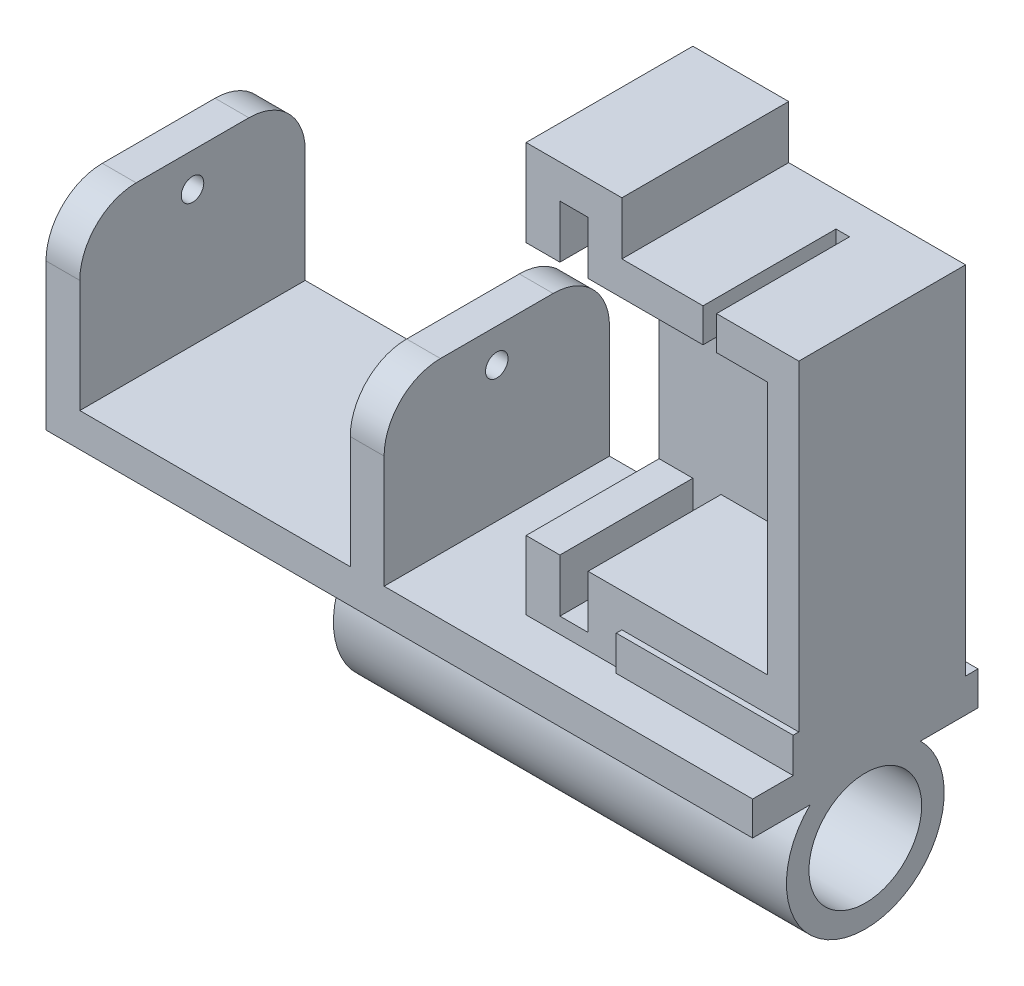
from build123d import *

# Parameters (mm, degrees)
SKETCH1_W           = 50
SKETCH1_H           = 20
BOSS_EXTRUDE1_DEPTH = 3
SKETCH2_W           = 3
SKETCH2_H           = 20
BOSS_EXTRUDE2_DEPTH = 15
SKETCH3_R           = 1
CUT_EXTRUDE1_DEPTH  = 15
FILLET1_R           = 5
SKETCH4_W           = 3
SKETCH4_H           = 20
BOSS_EXTRUDE3_DEPTH = 15
CUT_EXTRUDE2_START  = -15
SKETCH5_R           = 1
CUT_EXTRUDE2_DEPTH  = 15
FILLET2_R           = 5
BOSS_EXTRUDE4_DEPTH = 5.9
SKETCH7_W           = 20
SKETCH7_H           = 3
BOSS_EXTRUDE5_DEPTH = 12.8
SKETCH8_W           = 15.8
SKETCH8_H           = 3.1
BOSS_EXTRUDE6_DEPTH = 6.4
BOSS_EXTRUDE7_DEPTH = 3
SKETCH10_W          = 43.689261584
SKETCH10_H          = 59.678024431
CUT_EXTRUDE4_DEPTH  = 0.2
SKETCH11_R          = 7
SKETCH11_R_2        = 5
BOSS_EXTRUDE8_DEPTH = 40.2


with BuildPart() as part:
    # Sketch1 → Boss-Extrude1 (new body)
    with BuildSketch(Plane(origin=(0, 0, 0), x_dir=(1, 0, 0), z_dir=(0, 1, 0))):
        with Locations((25, -10)):
            Rectangle(SKETCH1_W, SKETCH1_H)
    extrude(amount=BOSS_EXTRUDE1_DEPTH)

    # Sketch2 → Boss-Extrude2 (add)
    with BuildSketch(Plane(origin=(0, 3, 0), x_dir=(1, 0, 0), z_dir=(0, 1, 0))):
        with Locations((1.5, -10)):
            Rectangle(SKETCH2_W, SKETCH2_H)
    extrude(amount=BOSS_EXTRUDE2_DEPTH)

    # Sketch3 → Cut-Extrude1 (cut)
    with BuildSketch(Plane(origin=(3, 0, 0), x_dir=(0, 0, -1), z_dir=(1, 0, 0))):
        with Locations((-10, 15)):
            Circle(SKETCH3_R)
    extrude(amount=-CUT_EXTRUDE1_DEPTH, mode=Mode.SUBTRACT)

    # Fillet1
    fillet1_edges = [part.edges().sort_by_distance(p)[0] for p in [
        (1.5, 18, 20),
        (1.5, 18, 0),
    ]]
    fillet(fillet1_edges, radius=FILLET1_R)

    # Sketch4 → Boss-Extrude3 (add)
    with BuildSketch(Plane(origin=(0, 3, 0), x_dir=(1, 0, 0), z_dir=(0, 1, 0))):
        with Locations((28.5, -10)):
            Rectangle(SKETCH4_W, SKETCH4_H)
    extrude(amount=BOSS_EXTRUDE3_DEPTH)

    # Sketch5 → Cut-Extrude2 (cut)
    with BuildSketch(Plane.ZY.offset(-27).offset(CUT_EXTRUDE2_START)):
        with Locations(Location((10, 15, 0), (0, 0, 180))):
            Circle(SKETCH5_R)
    extrude(amount=CUT_EXTRUDE2_DEPTH, mode=Mode.SUBTRACT)

    # Fillet2
    fillet2_edges = [part.edges().sort_by_distance(p)[0] for p in [
        (28.5, 18, 20),
        (28.5, 18, 0),
    ]]
    fillet(fillet2_edges, radius=FILLET2_R)

    # Sketch6 → Boss-Extrude4 (add, symmetric)
    with BuildSketch(Plane(origin=(0, 0, 10), x_dir=(-1, 0, 0), z_dir=(0, 0, -1))):
        Polygon((-38.5, 31.6), (-38.5, 34.6), (-38.5, 39.3), (-47, 39.3), (-47, 34.6), (-54.2, 34.6), (-54.2, 31.6), (-44, 31.6), (-44, 36.3), (-41.5, 36.3), (-41.5, 31.6), align=None)
        Polygon((-38.5, 1.4), (-38.5, 6.1), (-38.5, 9.1), (-41.5, 9.1), (-41.5, 4.4), (-44, 4.4), (-44, 9.1), (-59.9, 9.1), (-59.9, 31.6), (-55.4, 31.6), (-55.4, 34.6), (-62.9, 34.6), (-62.9, 6.1), (-47, 6.1), (-47, 1.4), align=None)
    extrude(amount=BOSS_EXTRUDE4_DEPTH, both=True)


with BuildPart() as boss_extrude4_piece_1:
    # of the separate pieces the step leaves, piece 1, a body of its own (boss_extrude4_pieces)
    add(part.part.solids().sort_by_distance((27, 13, 0))[0])

    # Sketch7 → Boss-Extrude5 (add)
    with BuildSketch(Plane(origin=(50, 0, 0), x_dir=(0, 0, -1), z_dir=(1, 0, 0))):
        with Locations((-10, 1.5)):
            Rectangle(SKETCH7_W, SKETCH7_H)
    extrude(amount=BOSS_EXTRUDE5_DEPTH)

    # Sketch8 → Boss-Extrude6 (add, symmetric)
    with BuildSketch(Plane(origin=(0, 0, 10), x_dir=(-1, 0, 0), z_dir=(0, 0, -1))):
        with Locations((-54.9, 4.55)):
            Rectangle(SKETCH8_W, SKETCH8_H)
    extrude(amount=BOSS_EXTRUDE6_DEPTH, both=True)



with BuildPart() as boss_extrude4_piece_2:
    # of the separate pieces the step leaves, piece 2, a body of its own (boss_extrude4_pieces)
    add(part.part.solids().sort_by_distance((38.5, 31.6, 15.9))[0])


with BuildPart() as boss_extrude4_piece_1_1:
    add(boss_extrude4_piece_1.part)

    add(boss_extrude4_piece_2.part)  # Boss-Extrude7 merges Boss-Extrude4 piece 2
    # Sketch9 → Boss-Extrude7 (add)
    with BuildSketch(Plane(origin=(0, 0, 4.1), x_dir=(-1, 0, 0), z_dir=(0, 0, -1))):
        Polygon((-38.5, 3), (-38.5, 39.3), (-47, 39.3), (-47, 34.6), (-62.9, 34.6), (-62.8, 3), align=None)
    extrude(amount=BOSS_EXTRUDE7_DEPTH)

    # Sketch10 → Cut-Extrude4 (cut)
    with BuildSketch(Plane(origin=(62.9, 0, 0), x_dir=(0, 0, -1), z_dir=(1, 0, 0))):
        with Locations((-9.388309177, 18.772485295)):
            Rectangle(SKETCH10_W, SKETCH10_H)
    extrude(amount=-CUT_EXTRUDE4_DEPTH, mode=Mode.SUBTRACT)

    # Sketch11 → Boss-Extrude8 (add)
    with BuildSketch(Plane(origin=(62.7, 0, 0), x_dir=(0, 0, -1), z_dir=(1, 0, 0))):
        with Locations((-10, -5)):
            Circle(SKETCH11_R)
        with Locations((-10, -5)):
            Circle(SKETCH11_R_2, mode=Mode.SUBTRACT)
    extrude(amount=-BOSS_EXTRUDE8_DEPTH)


solid = boss_extrude4_piece_1_1.part
